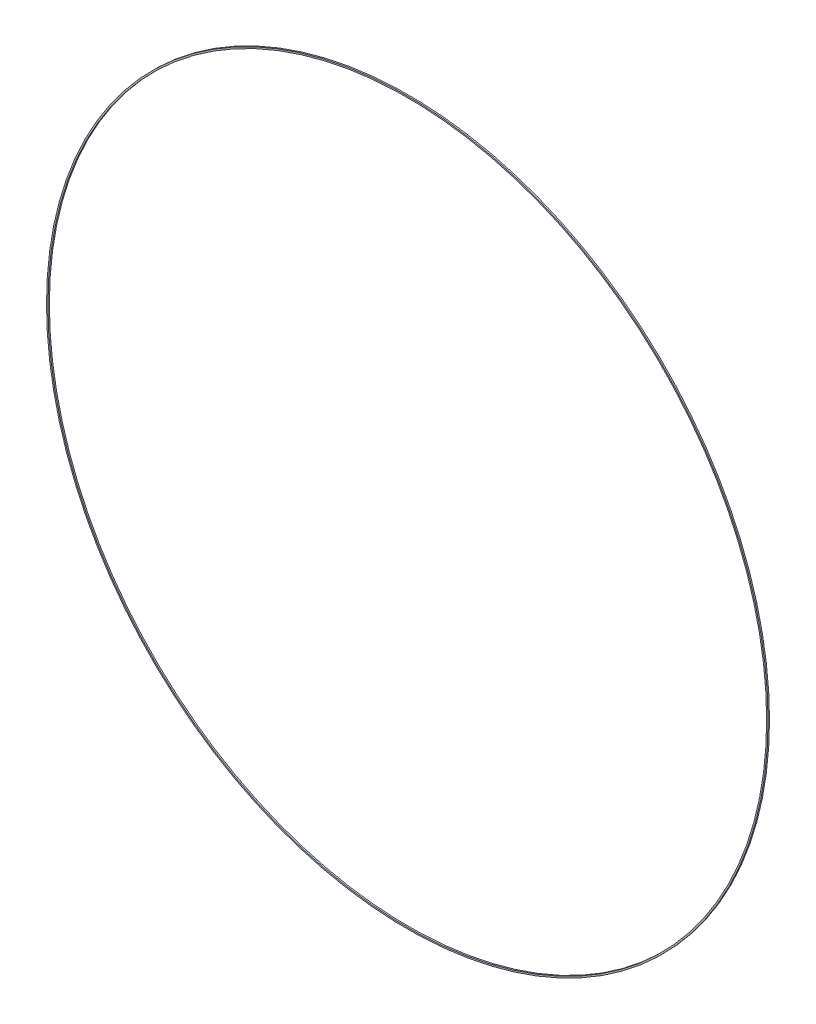
from build123d import *

# Parameters (mm, degrees)
SKETCH1_R           = 500.5
SKETCH1_R_2         = 498.5
BOSS_EXTRUDE1_DEPTH = 2


with BuildPart() as part:
    # Sketch1 → Boss-Extrude1 (new body)
    with BuildSketch(Plane.XY):
        with Locations((0, -500.5)):
            Circle(SKETCH1_R)
        with Locations((0, -500.5)):
            Circle(SKETCH1_R_2, mode=Mode.SUBTRACT)
    extrude(amount=BOSS_EXTRUDE1_DEPTH)


solid = part.part
